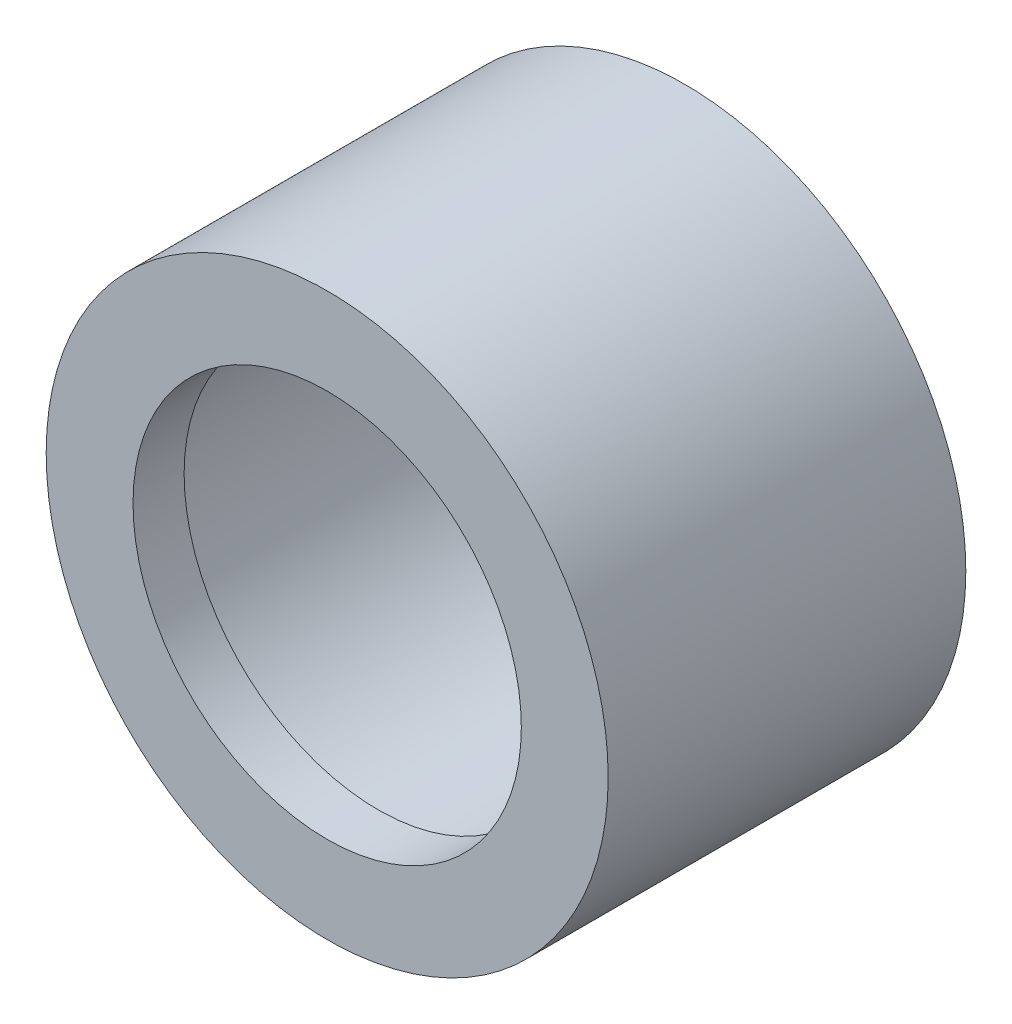
from build123d import *

# Parameters (mm, degrees)
SKETCH_1_R          = 27.5
EXTRUDE_1_DEPTH     = 3
SKETCH_2_R          = 27.5
EXTRUDE_2_DEPTH     = 32
SKETCH_3_R          = 21
CUT_EXTRUDE_1_DEPTH = 30
SKETCH_4_R          = 19
CUT_EXTRUDE_2_DEPTH = 30
SKETCH_5_R          = 25
CUT_EXTRUDE_3_DEPTH = 3.5


with BuildPart() as part:
    # 草图1 → 拉伸1 (new body)
    with BuildSketch(Plane.XY):
        Circle(SKETCH_1_R)
    extrude(amount=EXTRUDE_1_DEPTH)

    # 草图2 → 拉伸2 (add)
    with BuildSketch(Plane.XY.offset(3)):
        Circle(SKETCH_2_R)
    extrude(amount=EXTRUDE_2_DEPTH)

    # 草图3 → 切除-拉伸1 (cut)
    with BuildSketch(Plane(origin=(0, 0, 0), x_dir=(-1, 0, 0), z_dir=(0, 0, -1))):
        Circle(SKETCH_3_R)
    extrude(amount=-CUT_EXTRUDE_1_DEPTH, mode=Mode.SUBTRACT)

    # 草图4 → 切除-拉伸2 (cut)
    with BuildSketch(Plane(origin=(0, 0, 30), x_dir=(-1, 0, 0), z_dir=(0, 0, -1))):
        Circle(SKETCH_4_R)
    extrude(amount=-CUT_EXTRUDE_2_DEPTH, mode=Mode.SUBTRACT)

    # 草图5 → 切除-拉伸3 (cut)
    with BuildSketch(Plane(origin=(0, 0, 0), x_dir=(-1, 0, 0), z_dir=(0, 0, -1))):
        Circle(SKETCH_5_R)
    extrude(amount=-CUT_EXTRUDE_3_DEPTH, mode=Mode.SUBTRACT)


solid = part.part
